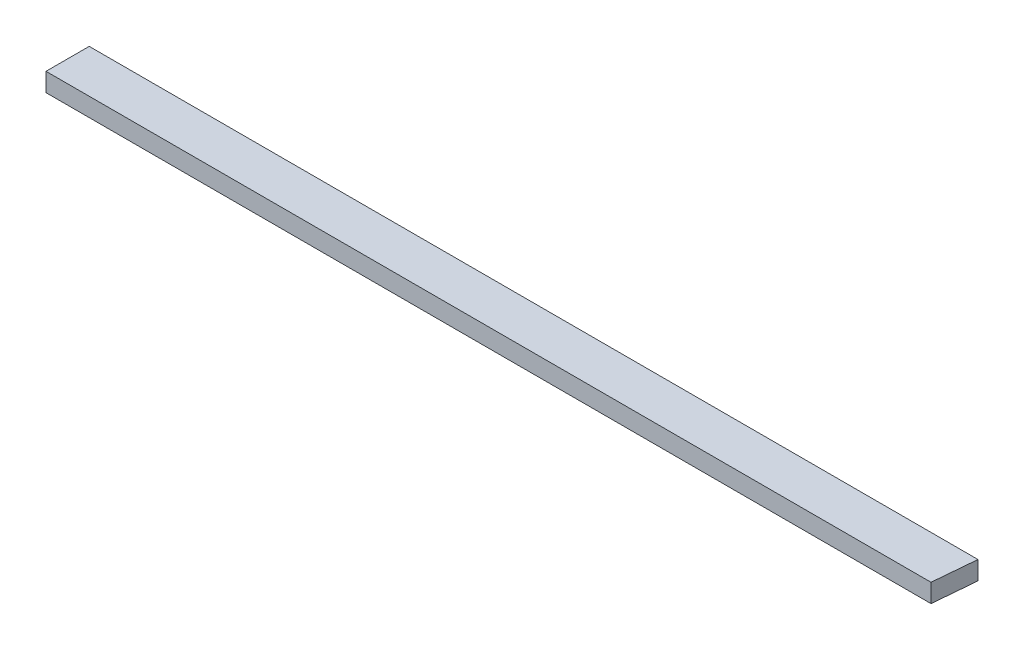
from build123d import *

# Parameters (mm, degrees)
BOSS_EXTRUDE1_DEPTH = 38.1


with BuildPart() as part:
    # Sketch1 → Boss-Extrude1 (new body)
    with BuildSketch(Plane(origin=(0, 0, 0), x_dir=(1, 0, 0), z_dir=(0, 1, 0))):
        Polygon((1828.8, 88.9), (1821.022257813, 0), (0, 0), (0, 88.9), align=None)
    extrude(amount=-BOSS_EXTRUDE1_DEPTH)


solid = part.part
